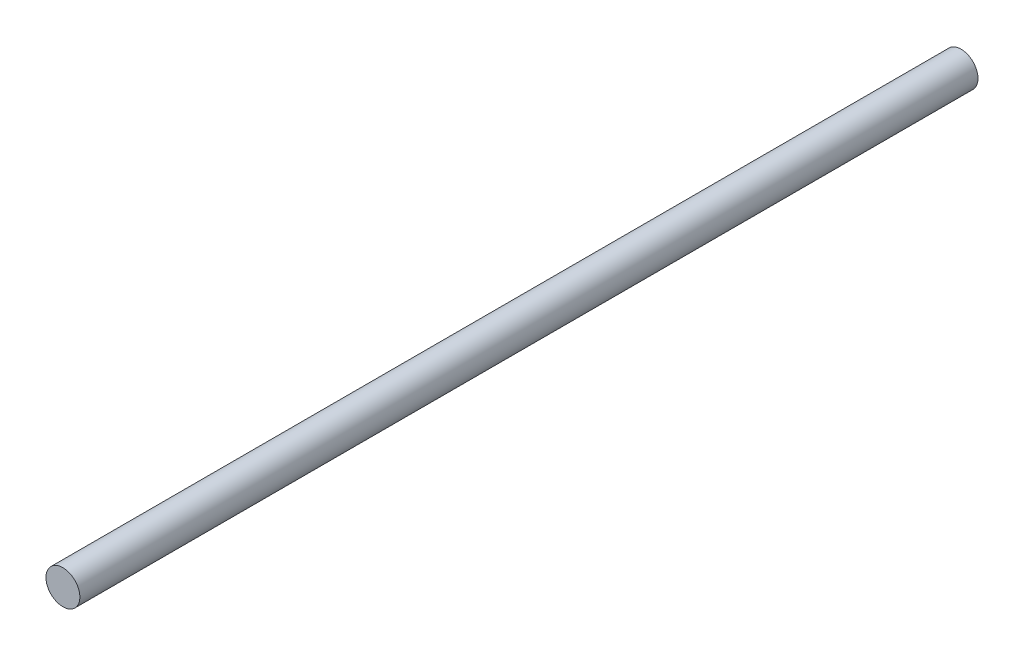
from build123d import *

# Parameters (mm, degrees)
SKETCH1_R           = 3.175
BOSS_EXTRUDE1_DEPTH = 84.1375


with BuildPart() as part:
    # Sketch1 → Boss-Extrude1 (new, symmetric)
    with BuildSketch(Plane.XY):
        with Locations((-142.875, 0)):
            Circle(SKETCH1_R)
    extrude(amount=BOSS_EXTRUDE1_DEPTH, both=True)


solid = part.part
